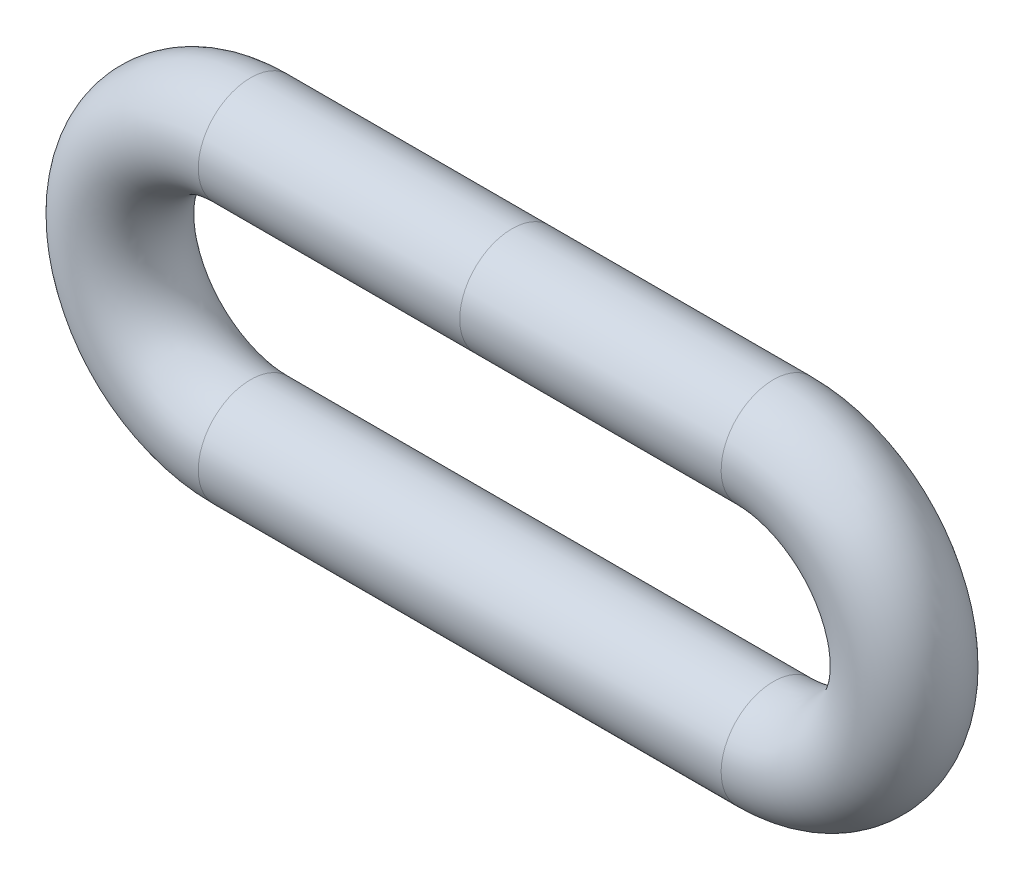
from build123d import *

# Parameters (mm, degrees)
SKETCH3_R = 1


with BuildPart() as part:
    # Sweep1: sweep along a path in Sketch1
    with BuildLine(Plane.XY) as sweep1_path:
        Line((-5, 2.5), (5, 2.5))
        ThreePointArc((5, 2.5), (7.5, 0), (5, -2.5))
        Line((5, -2.5), (-5, -2.5))
        ThreePointArc((-5, -2.5), (-7.5, 0), (-5, 2.5))
    # Sketch3 → Sweep1 (sweep)
    with BuildSketch(Plane(origin=(0, 0, 0), x_dir=(0, 0, -1), z_dir=(1, 0, 0))):
        with Locations((0, 2.5)):
            Circle(SKETCH3_R)
    sweep(path=sweep1_path.line)


solid = part.part
